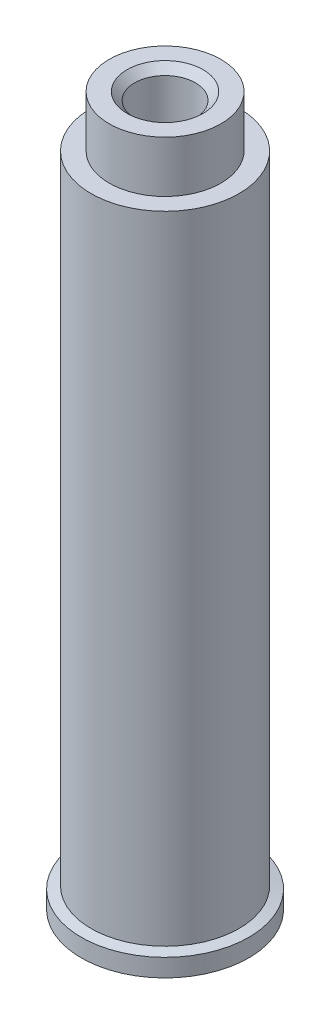
from build123d import *


with BuildPart() as part:
    # Sketch1 → Revolve1 (revolve)
    with BuildSketch(Plane.XY, mode=Mode.PRIVATE) as revolve1_sk:
        Polygon((3.9751, -11.938), (3.9751, 22.987), (1.7272, 24.28482567), (1.7272, 27.8892), (2.159, 28.321), (3.175, 28.321), (3.175, 25.4), (4.2037, 25.4), (4.2037, -10.772269991), (4.7625, -10.922), (4.7625, -11.938), align=None)
    revolve(revolve1_sk.sketch.rotate(Axis((0, -164.610288724, 0), (0, 1, 0)), 90), axis=Axis((0, -164.610288724, 0), (0, 1, 0)))


solid = part.part
